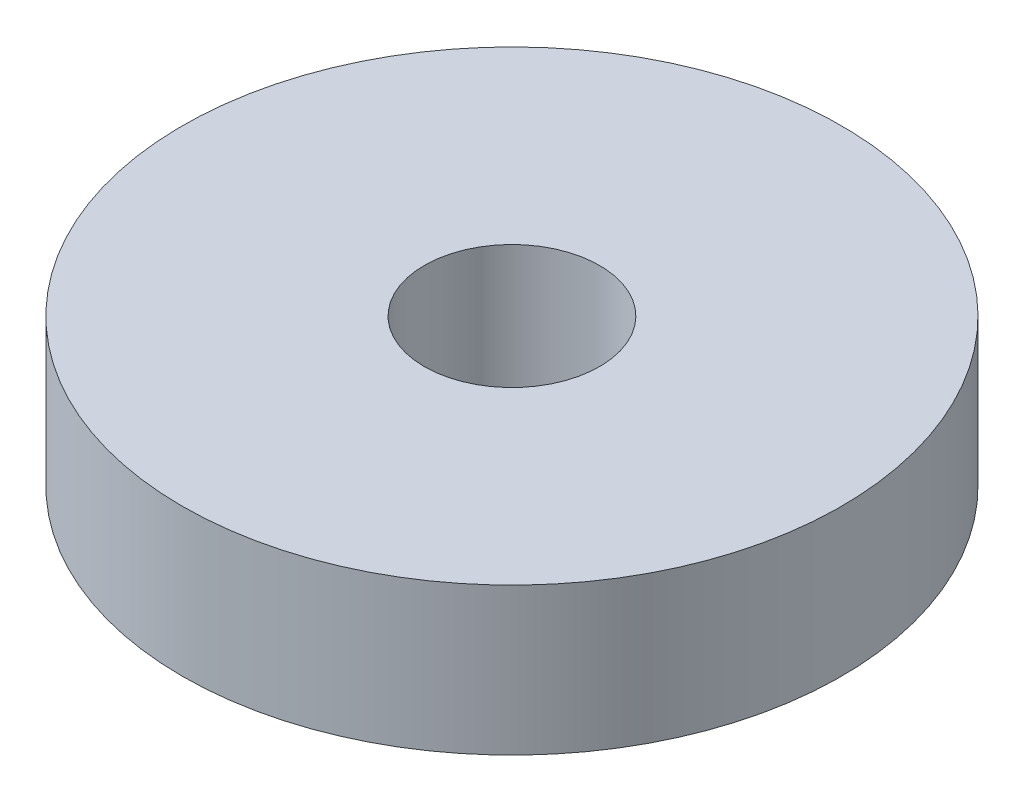
from build123d import *

# Parameters (mm, degrees)
SKETCH1_R           = 9.4
SKETCH1_R_2         = 2.5
BOSS_EXTRUDE1_DEPTH = 4.2


with BuildPart() as part:
    # Sketch1 → Boss-Extrude1 (new body)
    with BuildSketch(Plane(origin=(0, 0, 0), x_dir=(1, 0, 0), z_dir=(0, 1, 0))):
        with Locations(Location((0, 0, 0), (0, 0, 270))):
            Circle(SKETCH1_R)
        with Locations(Location((0, 0, 0), (0, 0, 270))):
            Circle(SKETCH1_R_2, mode=Mode.SUBTRACT)
    extrude(amount=BOSS_EXTRUDE1_DEPTH)


solid = part.part
